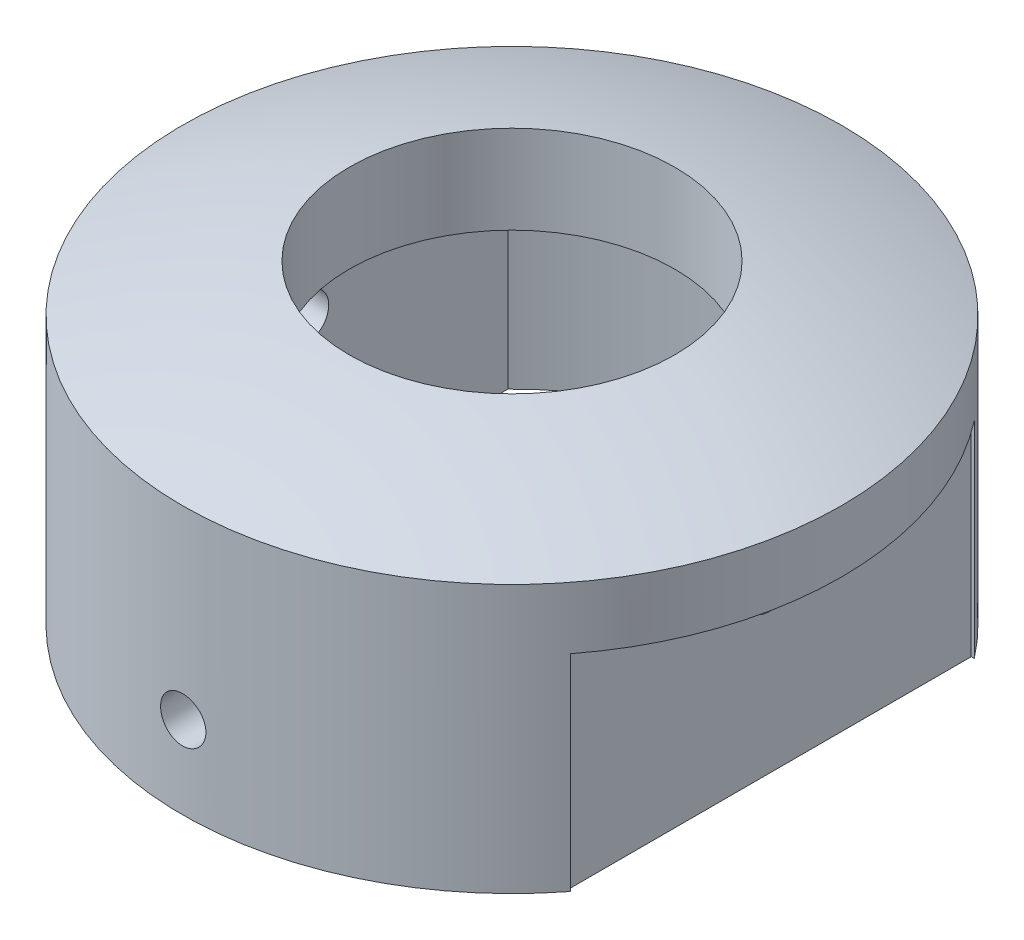
from build123d import *

# Parameters (mm, degrees)
CROQUIS1_R              = 16
SALIENTE_EXTRUIR1_DEPTH = 13
VACIADO1_T              = -2
CROQUIS2_W              = 7.778512226
CROQUIS2_H              = 19.595917942
CROQUIS2_W_2            = 8.965433382
CORTAR_EXTRUIR1_DEPTH   = 10
SALIENTE_EXTRUIR2_REACH = 28.096
CROQUIS3_W              = 2.5
CROQUIS3_H              = 19.595917942
CROQUIS4_R              = 1.1
CORTAR_EXTRUIR2_DEPTH   = 36.174564674
CROQUIS5_R              = 1.1
CORTAR_EXTRUIR3_DEPTH   = 47.786750261
C_PULA1_FACE_RADIUS     = 16
C_PULA1_HEIGHT          = 3
CROQUIS7_R              = 7.9
CORTAR_EXTRUIR4_DEPTH   = 10


with BuildPart() as part:
    # Croquis1 → Saliente-Extruir1 (new body)
    with BuildSketch(Plane(origin=(0, 0, 0), x_dir=(1, 0, 0), z_dir=(0, 1, 0))):
        with Locations(Location((0, 0, 0), (0, 0, 90))):
            Circle(CROQUIS1_R)
    extrude(amount=SALIENTE_EXTRUIR1_DEPTH)

    # Vaciado1
    vaciado1_openings = [part.faces().sort_by_distance(p)[0] for p in [
        (0, 0, 0),
    ]]
    offset(amount=VACIADO1_T, openings=vaciado1_openings, kind=Kind.INTERSECTION)

    # Croquis2 → Cortar-Extruir1 (cut)
    with BuildSketch(Plane.XZ):
        with Locations((13.889256113, 0)):
            Rectangle(CROQUIS2_W, CROQUIS2_H)
        with Locations((-14.482716691, 0)):
            Rectangle(CROQUIS2_W_2, CROQUIS2_H)
    extrude(amount=-CORTAR_EXTRUIR1_DEPTH, mode=Mode.SUBTRACT)

    # Croquis3 → Saliente-Extruir2 (add, up to next)
    with BuildSketch(Plane.XZ, mode=Mode.PRIVATE) as saliente_extruir2_sk1:
        with Locations((-11.25, 0)):
            Rectangle(CROQUIS3_W, CROQUIS3_H)
    saliente_extruir2_tool1 = extrude(saliente_extruir2_sk1.sketch, amount=-SALIENTE_EXTRUIR2_REACH, mode=Mode.PRIVATE) - part.part
    # Croquis3 → Saliente-Extruir2 (add, up to next)
    with BuildSketch(Plane.XZ, mode=Mode.PRIVATE) as saliente_extruir2_sk2:
        with Locations((11.25, 0)):
            Rectangle(CROQUIS3_W, CROQUIS3_H)
    saliente_extruir2_tool2 = extrude(saliente_extruir2_sk2.sketch, amount=-SALIENTE_EXTRUIR2_REACH, mode=Mode.PRIVATE) - part.part
    add(saliente_extruir2_tool1.solids().sort_by_distance((-11.25, 0, 0))[0])
    add(saliente_extruir2_tool2.solids().sort_by_distance((11.25, 0, 0))[0])

    # Croquis4 → Cortar-Extruir2 (cut, through all)
    with BuildSketch(Plane.ZY.offset(12.5)):
        with Locations((0, 7.9)):
            Circle(CROQUIS4_R)
    extrude(amount=-CORTAR_EXTRUIR2_DEPTH, mode=Mode.SUBTRACT)

    # Croquis5 → Cortar-Extruir3 (cut, through all)
    with BuildSketch(Plane.XY.offset(26)):
        with Locations((0, 4)):
            Circle(CROQUIS5_R)
    extrude(amount=-CORTAR_EXTRUIR3_DEPTH, mode=Mode.SUBTRACT)

    # Cúpula1: a dome of height H over a round flat face of radius A is a cap of a sphere of radius (A * A + H * H) / (2 * H)
    c_pula1_r = (C_PULA1_FACE_RADIUS * C_PULA1_FACE_RADIUS + C_PULA1_HEIGHT * C_PULA1_HEIGHT) / (2 * C_PULA1_HEIGHT)
    c_pula1_base = Plane((0, 13, 0), z_dir=(0, 1, 0))
    with Locations(c_pula1_base.offset(C_PULA1_HEIGHT - c_pula1_r)):
        c_pula1_ball = Sphere(c_pula1_r, mode=Mode.PRIVATE)
    add(split(c_pula1_ball, bisect_by=c_pula1_base, keep=Keep.TOP, mode=Mode.PRIVATE))

    # Croquis7 → Cortar-Extruir4 (cut)
    with BuildSketch(Plane.XZ.offset(-11)):
        with Locations(Location((0, 0, 0), (0, 0, 270))):
            Circle(CROQUIS7_R)
    extrude(amount=-CORTAR_EXTRUIR4_DEPTH, mode=Mode.SUBTRACT)


solid = part.part
